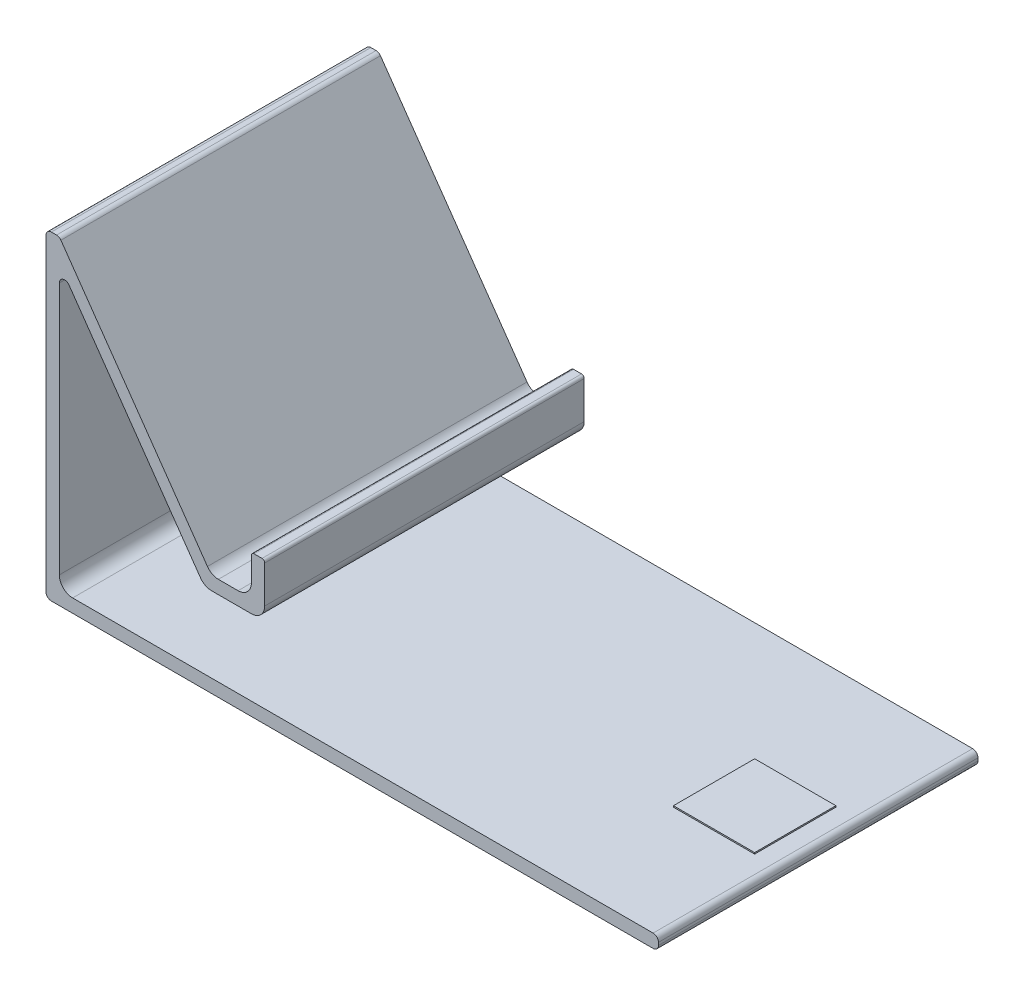
from build123d import *

# Parameters (mm, degrees)
BOSS_EXTRUDE1_DEPTH = 120
SKETCH3_W           = 30
SKETCH3_H           = 30
BOSS_EXTRUDE2_DEPTH = 3
SKETCH6_W           = 30.5
SKETCH6_H           = 30.5
BOSS_EXTRUDE3_DEPTH = 5.5


with BuildPart() as part:
    # Sketch1 → Boss-Extrude1 (new body)
    with BuildSketch(Plane.XY):
        with BuildLine():
            Line((2, 0), (228, 0))
            ThreePointArc((228, 0), (229.414213562, 0.585786438), (230, 2))
            Line((230, 2), (230, 3))
            ThreePointArc((230, 3), (229.414213562, 4.414213562), (228, 5))
            Line((228, 5), (10, 5))
            ThreePointArc((10, 5), (6.464466094, 6.464466094), (5, 10))
            Line((5, 10), (5, 104.939576417))
            ThreePointArc((5, 104.939576417), (6.398588401, 106.847010319), (8.638304089, 106.08672929))
            Line((8.638304089, 106.08672929), (58.028349014, 35.550435076))
            ThreePointArc((58.028349014, 35.550435076), (59.815366169, 33.983263092), (62.124109236, 33.418317258))
            Line((62.124109236, 33.418317258), (77.124109236, 33.418317258))
            ThreePointArc((77.124109236, 33.418317258), (80.659643142, 34.882783352), (82.124109236, 38.418317258))
            Line((82.124109236, 38.418317258), (82.124109236, 52.418317258))
            ThreePointArc((82.124109236, 52.418317258), (81.831216017, 53.125424039), (81.124109236, 53.418317258))
            Line((81.124109236, 53.418317258), (78.124109236, 53.418317258))
            ThreePointArc((78.124109236, 53.418317258), (77.417002454, 53.125424039), (77.124109236, 52.418317258))
            Line((77.124109236, 52.418317258), (77.124109236, 43.418317258))
            ThreePointArc((77.124109236, 43.418317258), (75.659643142, 39.882783352), (72.124109236, 38.418317258))
            Line((72.124109236, 38.418317258), (64.726944488, 38.418317258))
            ThreePointArc((64.726944488, 38.418317258), (62.418201422, 38.983263092), (60.631184267, 40.550435076))
            Line((60.631184267, 40.550435076), (5.597169987, 119.147152873))
            ThreePointArc((5.597169987, 119.147152873), (4.882363125, 119.774021666), (3.958865899, 120))
            Line((3.958865899, 120), (2, 120))
            ThreePointArc((2, 120), (0.585786438, 119.414213562), (0, 118))
            Line((0, 118), (0, 2))
            ThreePointArc((0, 2), (0.585786438, 0.585786438), (2, 0))
        make_face()
    extrude(amount=BOSS_EXTRUDE1_DEPTH)

    # Sketch3 → Boss-Extrude2 (add)
    with BuildSketch(Plane(origin=(0, 0, 0), x_dir=(1, 0, 0), z_dir=(0, 1, 0))):
        with Locations((205, -60)):
            Rectangle(SKETCH3_W, SKETCH3_H)
    extrude(amount=BOSS_EXTRUDE2_DEPTH)

    # Sketch6 → Boss-Extrude3 (add)
    with BuildSketch(Plane(origin=(0, 0, 0), x_dir=(1, 0, 0), z_dir=(0, 1, 0))):
        with Locations((206.124109236, -60)):
            Rectangle(SKETCH6_W, SKETCH6_H)
    extrude(amount=BOSS_EXTRUDE3_DEPTH)


solid = part.part
